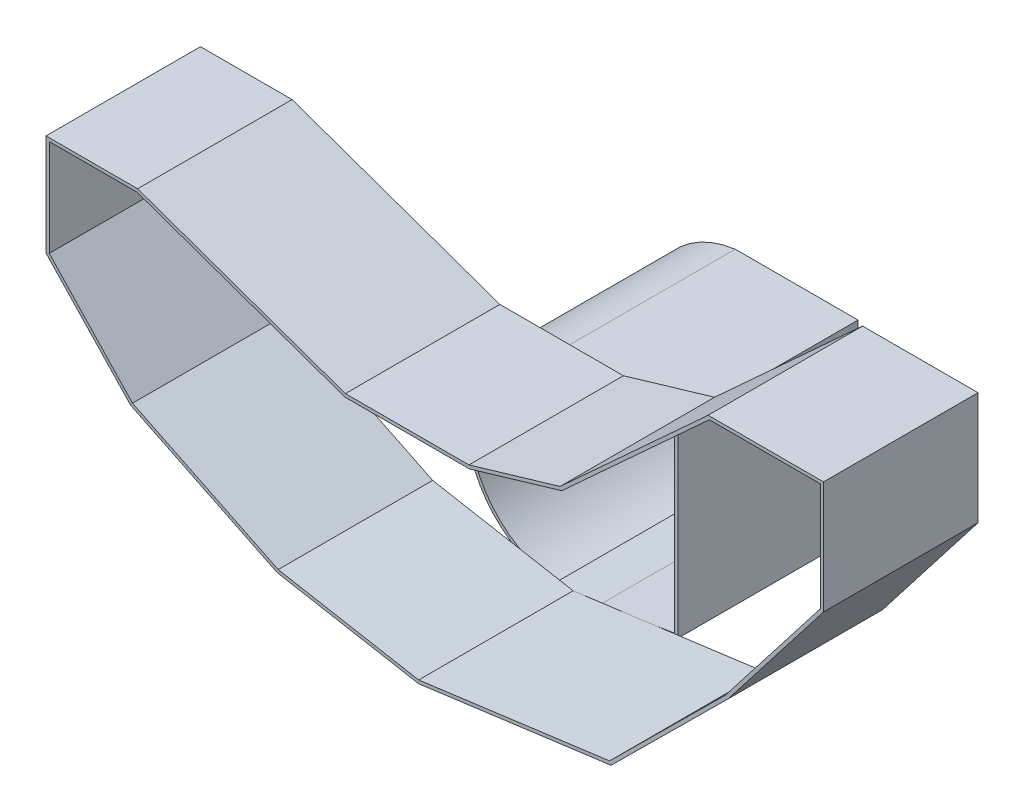
from build123d import *

# Parameters (mm, degrees)
BOSS_EXTRUDE1_DEPTH = 120.65
BOSS_EXTRUDE2_DEPTH = 140.716


with BuildPart() as part:
    # Sketch1 → Boss-Extrude1 (new body)
    with BuildSketch(Plane.XY):
        Polygon((-291.084, 147.066), (-219.52806053, 147.066), (-57.22206053, 89.662), (39.256240725, 89.662), (110.476764153, 110.727225239), (226.088273147, 216.662), (316.23, 216.662), (316.23, 128.670079749), (241.68157023, 32.602515613), (150.279663639, -58.03130773), (-0.059802851, -78.008272613), (-110.526524053, -58.062892396), (-225.049772802, -2.07942928), (-291.084, 67.823990918), align=None)
        Polygon((111.76, 108.458), (39.624, 87.122), (-57.658, 87.122), (-219.964, 144.526), (-288.544, 144.526), (-288.544, 68.834), (-223.52, 0), (-109.728, -55.626), (0, -75.438), (149.098, -55.626), (239.776, 34.29), (313.69, 129.54), (313.69, 214.122), (227.076, 214.122), align=None, mode=Mode.SUBTRACT)
    extrude(amount=-BOSS_EXTRUDE1_DEPTH)

    # Sketch2 → Boss-Extrude2 (add)
    with BuildSketch(Plane(origin=(0, 0, -120.65), x_dir=(-1, 0, 0), z_dir=(0, 0, -1))):
        with BuildLine():
            Line((-81.788, 78.232), (14.098209979, 78.232))
            ThreePointArc((14.098209979, 78.232), (83.312, -0.762), (14.098209979, -79.756))
            Line((14.098209979, -79.756), (-21.914681881, -76.180251872))
            Line((-21.914681881, -76.180251872), (-81.788, -66.684923888))
            Line((-81.788, -66.684923888), (-81.788, 78.232))
        make_face()
        with BuildLine():
            Line((-79.248, 75.692), (-79.248, -64.516))
            Line((-79.248, -64.516), (-21.59, -73.66))
            Line((-21.59, -73.66), (14.224, -77.216))
            ThreePointArc((14.224, -77.216), (80.772, 0), (12.495590487, 75.692))
            Line((12.495590487, 75.692), (-79.248, 75.692))
        make_face(mode=Mode.SUBTRACT)
    extrude(amount=BOSS_EXTRUDE2_DEPTH)


solid = part.part
